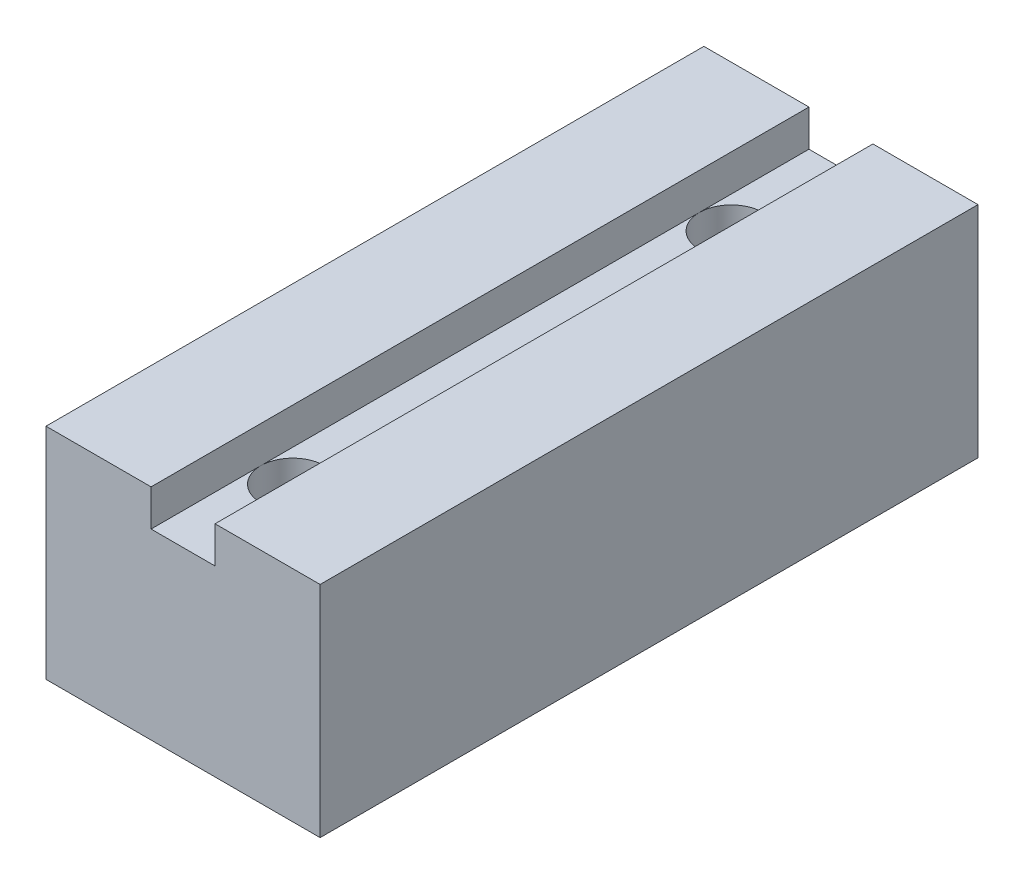
from build123d import *

# Parameters (mm, degrees)
SKETCH1_W           = 15
SKETCH1_H           = 36
BOSS_EXTRUDE1_DEPTH = 12
SKETCH2_R           = 1.75
CUT_EXTRUDE1_DEPTH  = 12
SKETCH3_W           = 3.5
SKETCH3_H           = 36
CUT_EXTRUDE2_DEPTH  = 2


with BuildPart() as part:
    # Sketch1 → Boss-Extrude1 (new body)
    with BuildSketch(Plane(origin=(0, 0, 0), x_dir=(1, 0, 0), z_dir=(0, 1, 0))):
        with Locations((7.5, 18)):
            Rectangle(SKETCH1_W, SKETCH1_H)
    extrude(amount=BOSS_EXTRUDE1_DEPTH)

    # Sketch2 → Cut-Extrude1 (cut)
    with BuildSketch(Plane(origin=(0, 12, 0), x_dir=(1, 0, 0), z_dir=(0, 1, 0))):
        with Locations(Location((7.5, 30, 0), (0, 0, 270))):
            Circle(SKETCH2_R)
        with Locations(Location((7.5, 6, 0), (0, 0, 270))):
            Circle(SKETCH2_R)
    extrude(amount=-CUT_EXTRUDE1_DEPTH, mode=Mode.SUBTRACT)

    # Sketch3 → Cut-Extrude2 (cut)
    with BuildSketch(Plane(origin=(0, 12, 0), x_dir=(1, 0, 0), z_dir=(0, 1, 0))):
        with Locations((7.5, 18)):
            Rectangle(SKETCH3_W, SKETCH3_H)
    extrude(amount=-CUT_EXTRUDE2_DEPTH, mode=Mode.SUBTRACT)


solid = part.part
